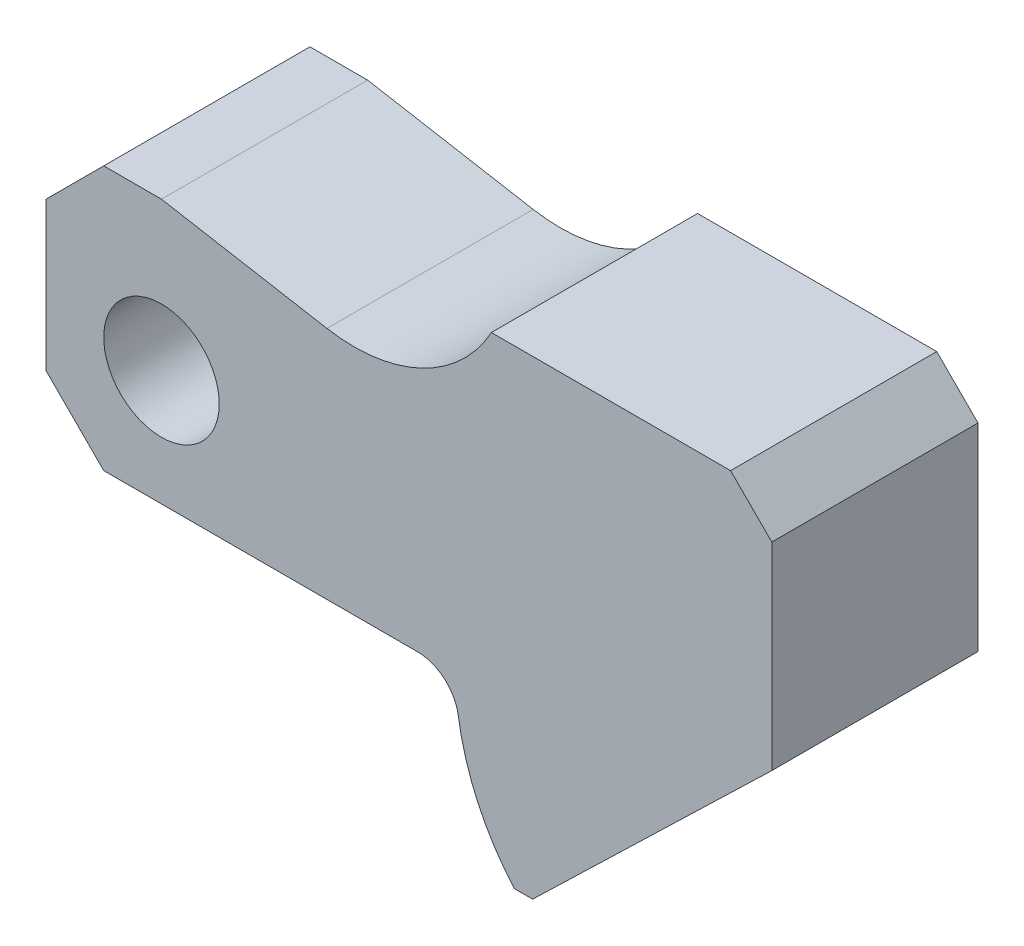
from build123d import *

# Parameters (mm, degrees)
SKETCH1_R           = 14
BOSS_EXTRUDE1_DEPTH = 50


with BuildPart() as part:
    # Sketch1 → Boss-Extrude1 (new body)
    with BuildSketch(Plane.XY):
        with BuildLine():
            Line((0, 0), (-76.096455974, 0))
            Line((-76.096455974, 0), (-90.096455974, 14))
            Line((-90.096455974, 14), (-90.096455974, 50))
            Line((-90.096455974, 50), (-76.096455974, 64))
            Line((-76.096455974, 64), (-62.096455974, 64))
            Line((-62.096455974, 64), (-21.972137383, 56.92500005))
            ThreePointArc((-21.972137383, 56.92500005), (1.024616064, 60.067940114), (17.903544026, 76))
            Line((17.903544026, 76), (75.903544026, 76))
            Line((75.903544026, 76), (85.903544026, 66))
            Line((85.903544026, 66), (85.903544026, 18))
            Line((85.903544026, 18), (27.903544026, -38))
            Line((27.903544026, -38), (23.442882283, -38))
            ThreePointArc((23.442882283, -38), (14.564937889, -24.231344122), (9.891277483, -8.529411765))
            ThreePointArc((9.891277483, -8.529411765), (6.530471562, -2.426827536), (0, 0))
        make_face()
        with Locations((-62.096455974, 28)):
            Circle(SKETCH1_R, mode=Mode.SUBTRACT)
    extrude(amount=BOSS_EXTRUDE1_DEPTH)


solid = part.part
